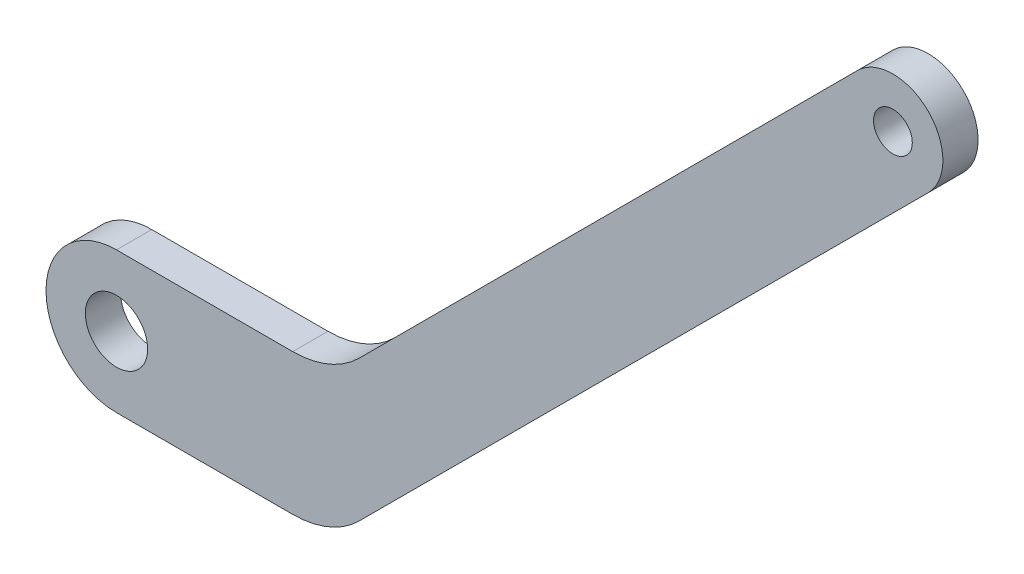
from build123d import *

# Parameters (mm, degrees)
EXTRUDE_1_DEPTH     = 3
SKETCH_9_R          = 2.65
SKETCH_9_R_2        = 1.65
CUT_EXTRUDE_5_DEPTH = 6


with BuildPart() as part:
    # 草图1 → 凸台-拉伸1 (new body)
    with BuildSketch(Plane.XY):
        with BuildLine():
            Line((0.000249999, 5.999750001), (14.999750012, 5.999750001))
            ThreePointArc((14.999750012, 5.999750001), (18.061380786, 6.60878139), (20.656854249, 8.343145751))
            Line((20.656854249, 8.343145751), (63.083261121, 50.769552622))
            ThreePointArc((63.083261121, 50.769552622), (69.093668761, 50.769552622), (69.093668761, 44.759144982))
            Line((69.093668761, 44.759144982), (20.65591759, -3.658290659))
            ThreePointArc((20.65591759, -3.658290659), (18.060942301, -5.391607293), (15.000249999, -6.000249999))
            Line((15.000249999, -6.000249999), (0.000249999, -6.000249999))
            ThreePointArc((0.000249999, -6.000249999), (-5.999750001, -0.000249999), (0.000249999, 5.999750001))
        make_face()
    extrude(amount=EXTRUDE_1_DEPTH)

    # 草图9 → 切除-拉伸5 (cut)
    with BuildSketch(Plane.XY.offset(3)):
        Circle(SKETCH_9_R)
        with Locations((66.088464941, 47.764348802)):
            Circle(SKETCH_9_R_2)
    extrude(amount=-CUT_EXTRUDE_5_DEPTH, mode=Mode.SUBTRACT)


solid = part.part
